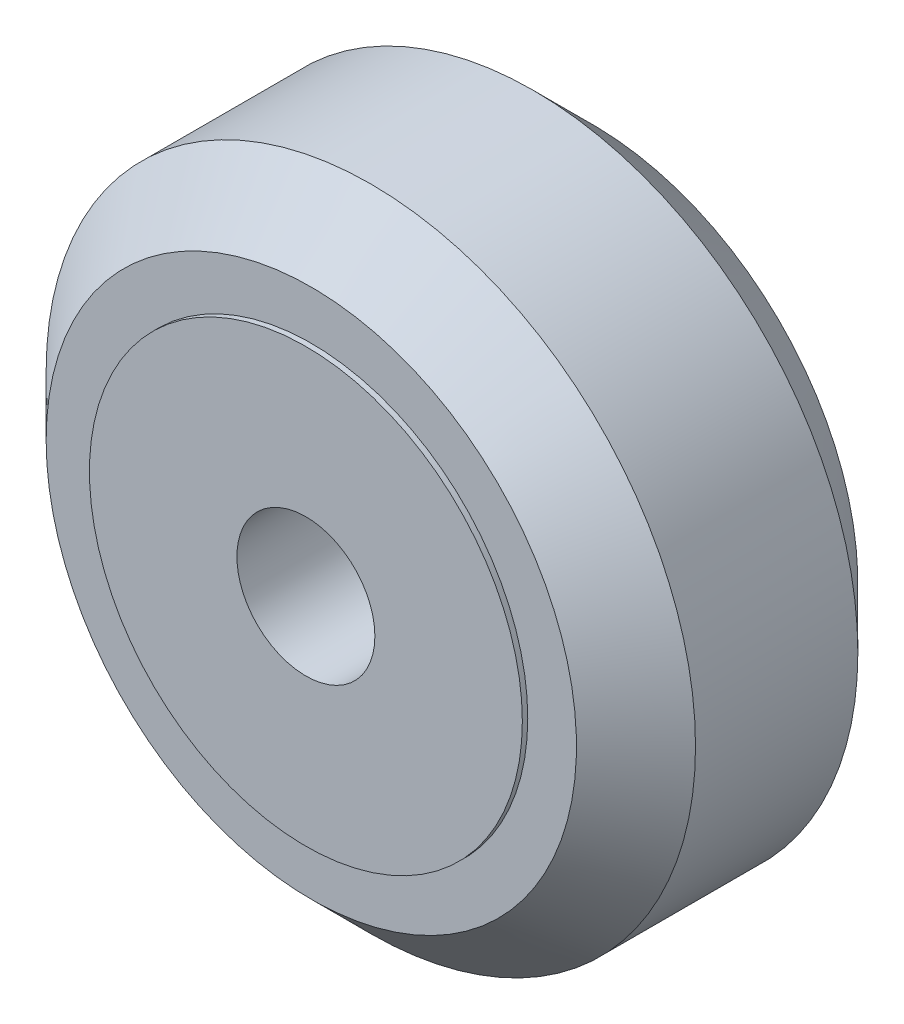
from build123d import *

# Parameters (mm, degrees)
SKETCH2_R           = 8
SKETCH2_R_2         = 2.55
BOSS_EXTRUDE1_DEPTH = 10.6
BOSS_EXTRUDE2_START = 0.2
SKETCH3_R           = 8
SKETCH3_R_2         = 2.55
BOSS_EXTRUDE2_DEPTH = 0.2


with BuildPart() as part:
    # Sketch1 → Revolve1 (revolve)
    with BuildSketch(Plane(origin=(0, 0, 0), x_dir=(0, 0, -1), z_dir=(1, 0, 0)), mode=Mode.PRIVATE) as revolve1_sk:
        Polygon((-0.645132269, 8), (-11.045132269, 8), (-11.045132269, 9.8), (-8.845132269, 12), (-2.845132269, 12), (-0.645132269, 9.8), align=None)
    revolve(revolve1_sk.sketch.rotate(Axis((0, 0, 0), (0, 0, 1)), 90), axis=Axis((0, 0, 0), (0, 0, 1)))

    # Sketch2 → Boss-Extrude1 (add)
    with BuildSketch(Plane.XY.offset(11.045132269)):
        Circle(SKETCH2_R)
        Circle(SKETCH2_R_2, mode=Mode.SUBTRACT)
    extrude(amount=-BOSS_EXTRUDE1_DEPTH)

    # Sketch3 → Boss-Extrude2 (add)
    with BuildSketch(Plane.XY.offset(11.045132269).offset(BOSS_EXTRUDE2_START)):
        Circle(SKETCH3_R)
        Circle(SKETCH3_R_2, mode=Mode.SUBTRACT)
    extrude(amount=-BOSS_EXTRUDE2_DEPTH)


solid = part.part
